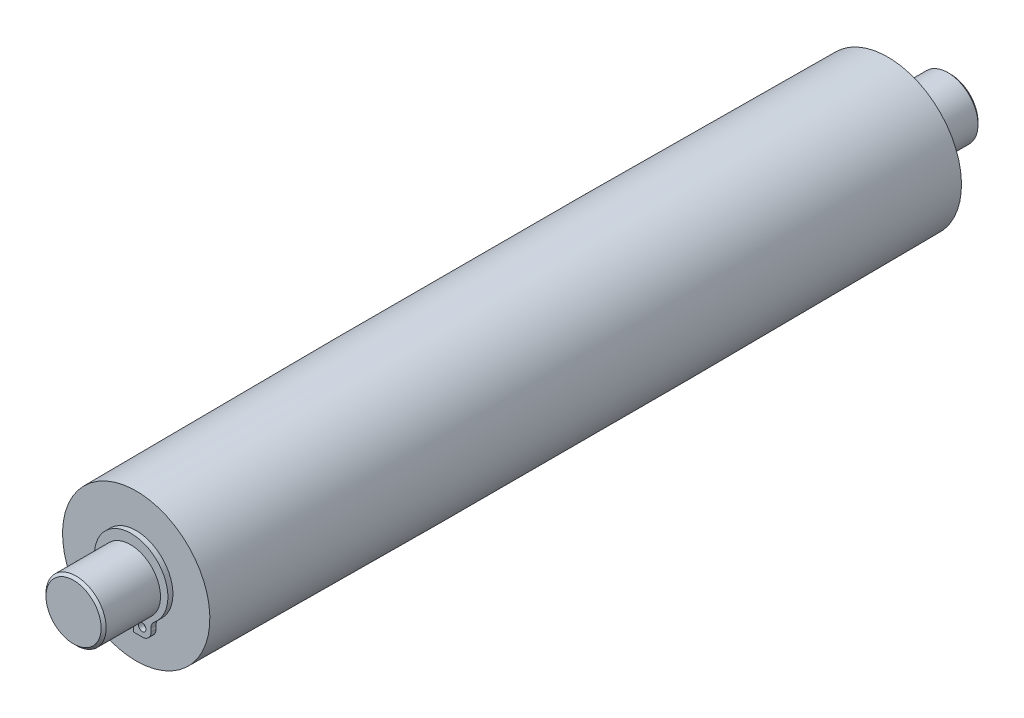
from build123d import *

# Parameters (mm, degrees)
BOSS_EXTRUDE1_START = 1
SKETCH2_R           = 0.75
BOSS_EXTRUDE1_DEPTH = 1
CHAMFER1_SIZE       = 0.5


with BuildPart() as part:
    # Sketch1 → Revolve1 (revolve)
    with BuildSketch(Plane(origin=(0, 0, 0), x_dir=(0, 0, -1), z_dir=(1, 0, 0)), mode=Mode.PRIVATE) as revolve1_sk:
        with BuildLine():
            Line((87.5, 6), (76.15, 6))
            Line((76.15, 6), (76.15, 5.75))
            Line((76.15, 5.75), (75, 5.75))
            Line((75, 5.75), (75, 14.7))
            ThreePointArc((75, 14.7), (0, 15), (-75, 14.7))
            Line((-75, 14.7), (-75, 5.75))
            Line((-75, 5.75), (-76.15, 5.75))
            Line((-76.15, 5.75), (-76.15, 6))
            Line((-76.15, 6), (-87.5, 6))
            Line((-87.5, 6), (-87.5, 0))
            Line((-87.5, 0), (87.5, 0))
            Line((87.5, 0), (87.5, 6))
        make_face()
    revolve(revolve1_sk.sketch.rotate(Axis((0, 0, 87.5), (0, 0, -1)), 180), axis=Axis((0, 0, 87.5), (0, 0, -1)))

    # Sketch2 → Boss-Extrude1 (add)
    with BuildSketch(Plane.XY.offset(75).offset(BOSS_EXTRUDE1_START)):
        with BuildLine():
            Line((-0.45, -8.95), (-0.45, -5.732364259))
            ThreePointArc((-0.45, -5.732364259), (0, 5.75), (0.45, -5.732364259))
            Line((0.45, -5.732364259), (0.45, -8.95))
            Line((0.45, -8.95), (2.25, -8.95))
            ThreePointArc((2.25, -8.95), (3.452081528, -8.452081528), (3.95, -7.25))
            Line((3.95, -7.25), (3.95, -6.512622113))
            ThreePointArc((3.95, -6.512622113), (4.117151006, -5.777520785), (4.585734072, -5.186975842))
            ThreePointArc((4.585734072, -5.186975842), (0, 7.85), (-4.585734072, -5.186975842))
            ThreePointArc((-4.585734072, -5.186975842), (-4.117151006, -5.777520785), (-3.95, -6.512622113))
            Line((-3.95, -6.512622113), (-3.95, -7.25))
            ThreePointArc((-3.95, -7.25), (-3.452081528, -8.452081528), (-2.25, -8.95))
            Line((-2.25, -8.95), (-0.45, -8.95))
        make_face()
        with Locations((-2.2, -7.25)):
            Circle(SKETCH2_R, mode=Mode.SUBTRACT)
        with Locations((2.2, -7.25)):
            Circle(SKETCH2_R, mode=Mode.SUBTRACT)
    boss_extrude1 = extrude(amount=-BOSS_EXTRUDE1_DEPTH)

    # Mirror1: Boss-Extrude1 across plane
    add(boss_extrude1.mirror(Plane.XY))

    # Chamfer1
    chamfer1_edges = [part.edges().sort_by_distance(p)[0] for p in [
        (0, 6, 87.5),
        (0, 6, -87.5),
    ]]
    chamfer(chamfer1_edges, length=CHAMFER1_SIZE)


solid = part.part
